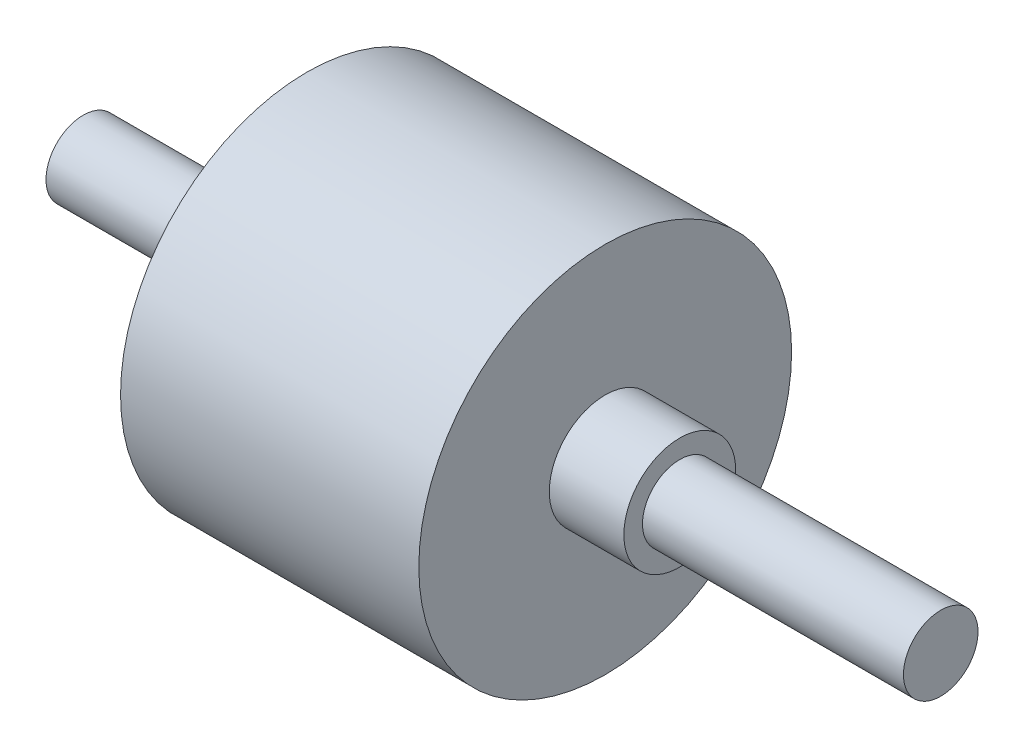
from build123d import *


with BuildPart() as part:
    # Sketch1 → Revolve1 (revolve)
    with BuildSketch(Plane.XY):
        Polygon((0, 0), (0, 5), (30, 5), (30, 25), (70, 25), (70, 7.5), (80, 7.5), (80, 5), (115, 5), (115, 0), align=None)
    revolve(axis=Axis((115, 0, 0), (-1, 0, 0)))


solid = part.part
